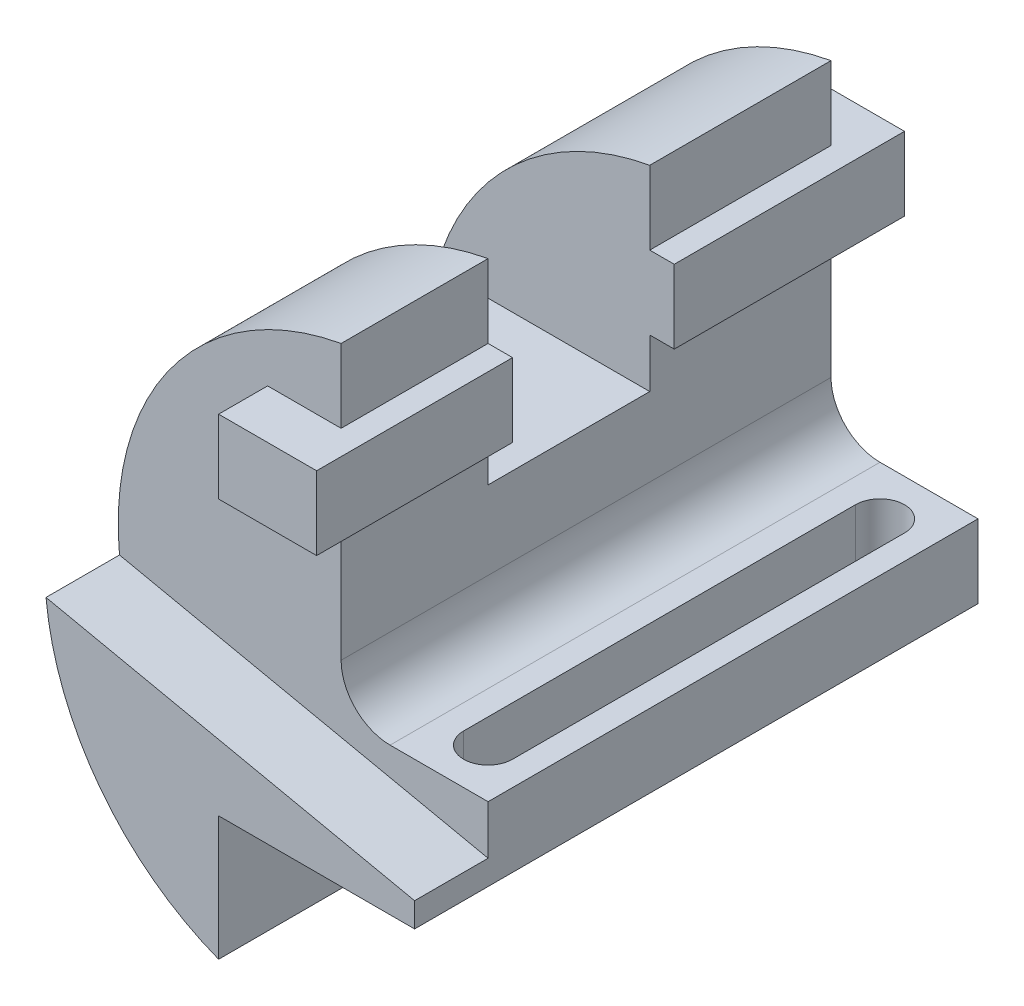
from build123d import *

# Parameters (mm, degrees)
BOSS_EXTRUDE1_DEPTH      = 115
CUT_EXTRUDE1_START       = -15
CUT_EXTRUDE1_DEPTH       = 15
BOSS_EXTRUDE2_DEPTH      = 10
BOSS_EXTRUDE2_DEPTH_BACK = 110
SKETCH3_W                = 20
SKETCH3_H                = 15
CUT_EXTRUDE2_DEPTH       = 148.83859442
CUT_EXTRUDE2_DEPTH_BACK  = 148.83859442
SKETCH4_W                = 33
SKETCH4_H                = 40
CUT_EXTRUDE3_DEPTH       = 153.581945197
FILLET1_R                = 10


with BuildPart() as part:
    # Sketch1 → Boss-Extrude1 (new body)
    with BuildSketch(Plane.XY):
        with BuildLine():
            Line((0, 0), (-40, 0))
            Line((-40, 0), (-40, -25.362796982))
            ThreePointArc((-40, -25.362796982), (-75.256322222, 31.603413808), (-30, 81))
            Line((-30, 81), (-30, 15))
            Line((-30, 15), (0, 15))
            Line((0, 15), (0, 0))
        make_face()
    extrude(amount=BOSS_EXTRUDE1_DEPTH)

    # Sketch2 → Cut-Extrude1 (cut)
    with BuildSketch(Plane.XY.offset(115).offset(CUT_EXTRUDE1_START)):
        with BuildLine():
            Line((0, 5), (-75.235044142, 20.9917023))
            ThreePointArc((-75.235044142, 20.9917023), (-64.318751046, 59.816391467), (-30, 81))
            Line((-30, 81), (-30, 15))
            Line((-30, 15), (0, 15))
            Line((0, 15), (0, 5))
        make_face()
    extrude(amount=CUT_EXTRUDE1_DEPTH, mode=Mode.SUBTRACT)

    # Sketch3 → Boss-Extrude2 (add, two sides: drawn at the far end of the back side and taken through both)
    with BuildSketch(Plane(origin=(0, 0, 0), x_dir=(-1, 0, 0), z_dir=(0, 0, -1)).offset(-BOSS_EXTRUDE2_DEPTH_BACK)):
        with Locations((35, 58.5)):
            Rectangle(SKETCH3_W, SKETCH3_H)
    extrude(amount=BOSS_EXTRUDE2_DEPTH + BOSS_EXTRUDE2_DEPTH_BACK)

    # Sketch4 → Cut-Extrude2 (cut, two sides: drawn at the far end of the back side and taken through both)
    with BuildSketch(Plane(origin=(-30, 0, 0), x_dir=(0, 0, -1), z_dir=(1, 0, 0)).offset(-CUT_EXTRUDE2_DEPTH_BACK)):
        with Locations((-53.5, 61)):
            Rectangle(SKETCH4_W, SKETCH4_H)
    extrude(amount=CUT_EXTRUDE2_DEPTH + CUT_EXTRUDE2_DEPTH_BACK, mode=Mode.SUBTRACT)

    # Sketch5 → Cut-Extrude3 (cut, through all)
    with BuildSketch(Plane(origin=(0, 15, 0), x_dir=(1, 0, 0), z_dir=(0, 1, 0))):
        with BuildLine():
            Line((-5, -10), (-5, -90))
            ThreePointArc((-5, -90), (-10, -95), (-15, -90))
            Line((-15, -90), (-15, -10))
            ThreePointArc((-15, -10), (-10, -5), (-5, -10))
        make_face()
    extrude(amount=-CUT_EXTRUDE3_DEPTH, mode=Mode.SUBTRACT)

    # Fillet1
    fillet1_edges = [part.edges().sort_by_distance(p)[0] for p in [
        (-30, 15, 50),
    ]]
    fillet(fillet1_edges, radius=FILLET1_R)


solid = part.part
